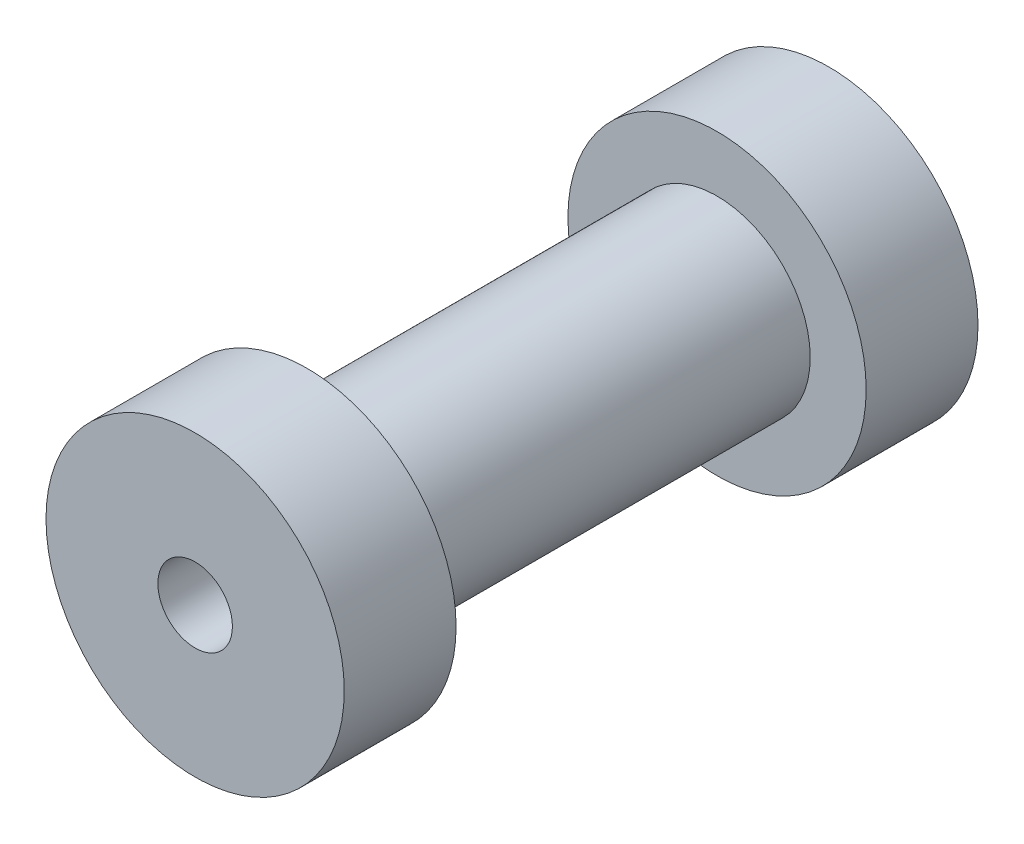
from build123d import *

# Parameters (mm, degrees)
CROQUIS1_R              = 4
SALIENTE_EXTRUIR1_DEPTH = 17
CROQUIS2_R              = 1
CORTAR_EXTRUIR1_DEPTH   = 18.916472867
CROQUIS3_W              = 11
CROQUIS3_H              = 1.5


with BuildPart() as part:
    # Croquis1 → Saliente-Extruir1 (new body)
    with BuildSketch(Plane.XY):
        Circle(CROQUIS1_R)
    extrude(amount=SALIENTE_EXTRUIR1_DEPTH)

    # Croquis2 → Cortar-Extruir1 (cut, through all)
    with BuildSketch(Plane.XY.offset(17)):
        Circle(CROQUIS2_R)
    extrude(amount=-CORTAR_EXTRUIR1_DEPTH, mode=Mode.SUBTRACT)

    # Croquis3 → Cortar-Revolución1 (revolve, cut)
    with BuildSketch(Plane(origin=(0, 0, 0), x_dir=(0, 0, -1), z_dir=(1, 0, 0)), mode=Mode.PRIVATE) as cortar_revoluci_n1_sk:
        with Locations((-8.5, 3.25)):
            Rectangle(CROQUIS3_W, CROQUIS3_H)
    revolve(cortar_revoluci_n1_sk.sketch.rotate(Axis((0, 0, 17), (0, 0, -1)), 90), axis=Axis((0, 0, 17), (0, 0, -1)), mode=Mode.SUBTRACT)


solid = part.part
